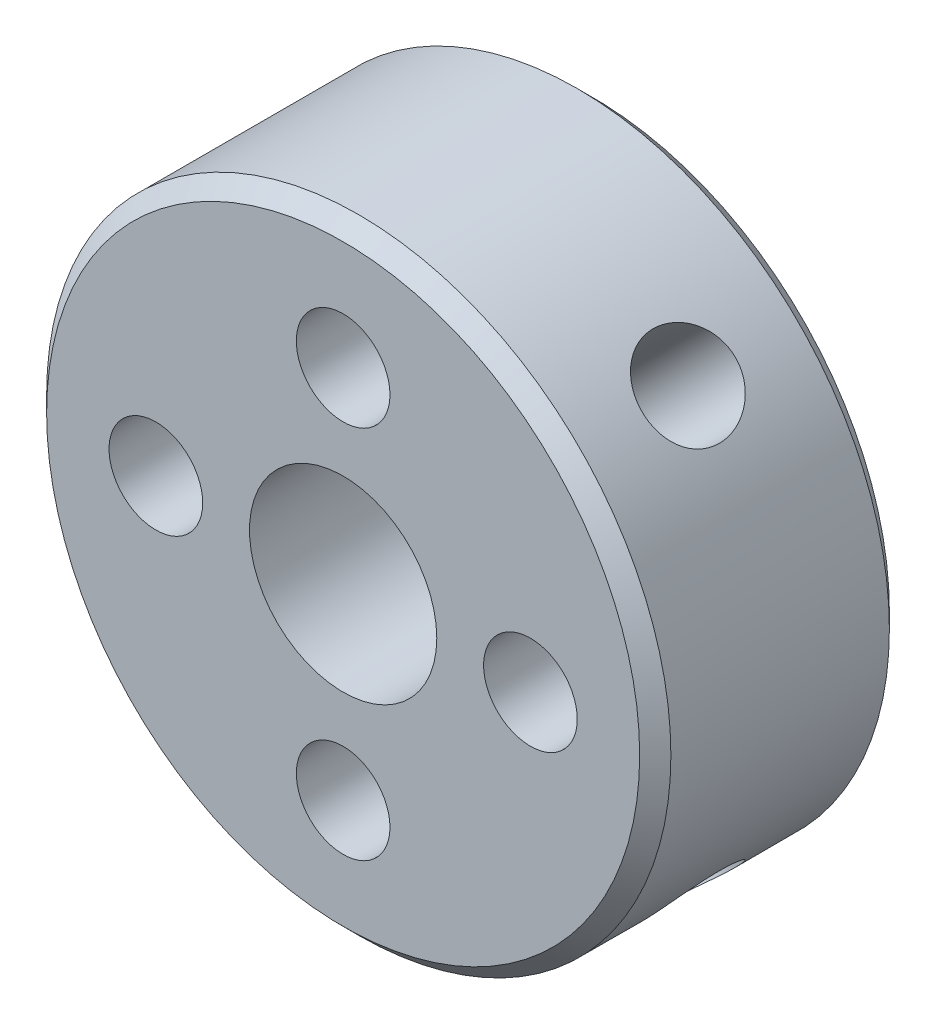
from build123d import *

# Parameters (mm, degrees)
SKETCH_1_R               = 10
SKETCH_1_R_2             = 3
SKETCH_1_R_3             = 1.5
EXTRUDE_1_DEPTH          = 8
CUT_EXTRUDE_1_REACH      = 18.248
CUT_EXTRUDE_1_END_RADIUS = 10
SKETCH_2_R               = 1.5
CUT_EXTRUDE_2_REACH      = 18.248
CUT_EXTRUDE_2_END_RADIUS = 10
SKETCH_3_R               = 1.5
CHAMFER_1_SIZE           = 0.5


with BuildPart() as part:
    # ｽｹｯﾁ1 → ﾎﾞｽ - 押し出し1 (new body)
    with BuildSketch(Plane.XY):
        Circle(SKETCH_1_R)
        Circle(SKETCH_1_R_2, mode=Mode.SUBTRACT)
        with Locations((-6, 0)):
            Circle(SKETCH_1_R_3, mode=Mode.SUBTRACT)
        with Locations((6, 0)):
            Circle(SKETCH_1_R_3, mode=Mode.SUBTRACT)
        with Locations((0, 6)):
            Circle(SKETCH_1_R_3, mode=Mode.SUBTRACT)
        with Locations((0, -6)):
            Circle(SKETCH_1_R_3, mode=Mode.SUBTRACT)
    extrude(amount=EXTRUDE_1_DEPTH)

    # ｶｯﾄ - 押し出し1: up to this cylinder (the profile starts inside it)
    cut_extrude_1_end = Plane(origin=(0, 0, 4), z_dir=(0, 0, -1)) * Cylinder(CUT_EXTRUDE_1_END_RADIUS, 57.496, mode=Mode.PRIVATE)
    # ｽｹｯﾁ2 → ｶｯﾄ - 押し出し1 (cut, up to the surface)
    with BuildSketch(Plane(origin=(0, 0, 0), x_dir=(0.7071067811865477, -0.7071067811865475, 0), z_dir=(0.7071067811865475, 0.7071067811865477, 0)), mode=Mode.PRIVATE) as cut_extrude_1_sk1:
        with Locations((0, -4)):
            Circle(SKETCH_2_R)
    cut_extrude_1_tool1 = extrude(cut_extrude_1_sk1.sketch, amount=CUT_EXTRUDE_1_REACH, mode=Mode.PRIVATE) & cut_extrude_1_end
    add(cut_extrude_1_tool1.solids().sort_by_distance((0, 0, 4))[0], mode=Mode.SUBTRACT)

    # ｶｯﾄ - 押し出し2: up to this cylinder (the profile starts inside it)
    cut_extrude_2_end = Plane(origin=(0, 0, 4), z_dir=(0, 0, -1)) * Cylinder(CUT_EXTRUDE_2_END_RADIUS, 57.496, mode=Mode.PRIVATE)
    # ｽｹｯﾁ3 → ｶｯﾄ - 押し出し2 (cut, up to the surface)
    with BuildSketch(Plane(origin=(0, 0, 0), x_dir=(0.7071067811865477, 0.7071067811865475, 0), z_dir=(-0.7071067811865475, 0.7071067811865477, 0)), mode=Mode.PRIVATE) as cut_extrude_2_sk1:
        with Locations(Location((0, -4, 0), (0, 0, 180))):
            Circle(SKETCH_3_R)
    cut_extrude_2_tool1 = extrude(cut_extrude_2_sk1.sketch, amount=-CUT_EXTRUDE_2_REACH, mode=Mode.PRIVATE) & cut_extrude_2_end
    add(cut_extrude_2_tool1.solids().sort_by_distance((0, 0, 4))[0], mode=Mode.SUBTRACT)

    # 面取り1
    chamfer_1_edges = [part.edges().sort_by_distance(p)[0] for p in [
        (-10, 0, 0),
        (-10, 0, 8),
    ]]
    chamfer(chamfer_1_edges, length=CHAMFER_1_SIZE)


solid = part.part
